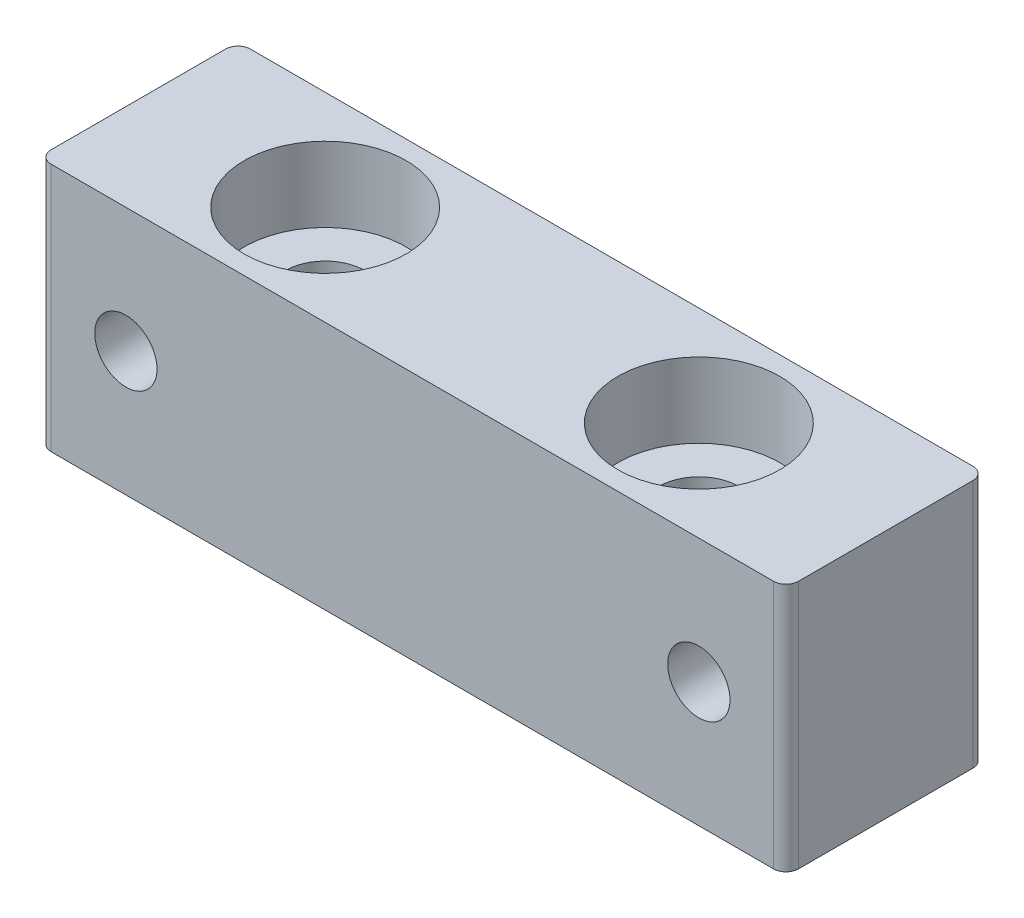
from build123d import *

# Parameters (mm, degrees)
SKETCH1_W                      = 30
SKETCH1_H                      = 8
BOSS_EXTRUDE1_DEPTH            = 10
CBORE_FOR_M3_SHCS2_D           = 3.2
CBORE_FOR_M3_SHCS2_CBORE_D     = 6.5
CBORE_FOR_M3_SHCS2_CBORE_DEPTH = 3
TAP_DRILL_FOR_M3X0_5_TAP1_D    = 2.5
FILLET1_R                      = 0.5


with BuildPart() as part:
    # Sketch1 → Boss-Extrude1 (new body)
    with BuildSketch(Plane(origin=(0, 0, 0), x_dir=(1, 0, 0), z_dir=(0, 1, 0))):
        Rectangle(SKETCH1_W, SKETCH1_H)
    extrude(amount=BOSS_EXTRUDE1_DEPTH)

    # CBORE for M3 SHCS2 (through all)
    with Locations(Plane(origin=(0, 10, 0), x_dir=(1, 0, 0), z_dir=(0, 1, 0))):
        with Locations((-7.5, 0), (7.5, 0)):
            CounterBoreHole(CBORE_FOR_M3_SHCS2_D / 2, CBORE_FOR_M3_SHCS2_CBORE_D / 2, CBORE_FOR_M3_SHCS2_CBORE_DEPTH)

    # Tap Drill for M3x0.5 Tap1 (through all)
    with Locations(Plane.XY.offset(4)):
        with Locations((-11.5, 5), (11.5, 5)):
            Hole(TAP_DRILL_FOR_M3X0_5_TAP1_D / 2)

    # Fillet1
    fillet1_edges = [part.edges().sort_by_distance(p)[0] for p in [
        (-15, 5, -4),
        (15, 5, -4),
        (15, 5, 4),
        (-15, 5, 4),
    ]]
    fillet(fillet1_edges, radius=FILLET1_R)


solid = part.part
